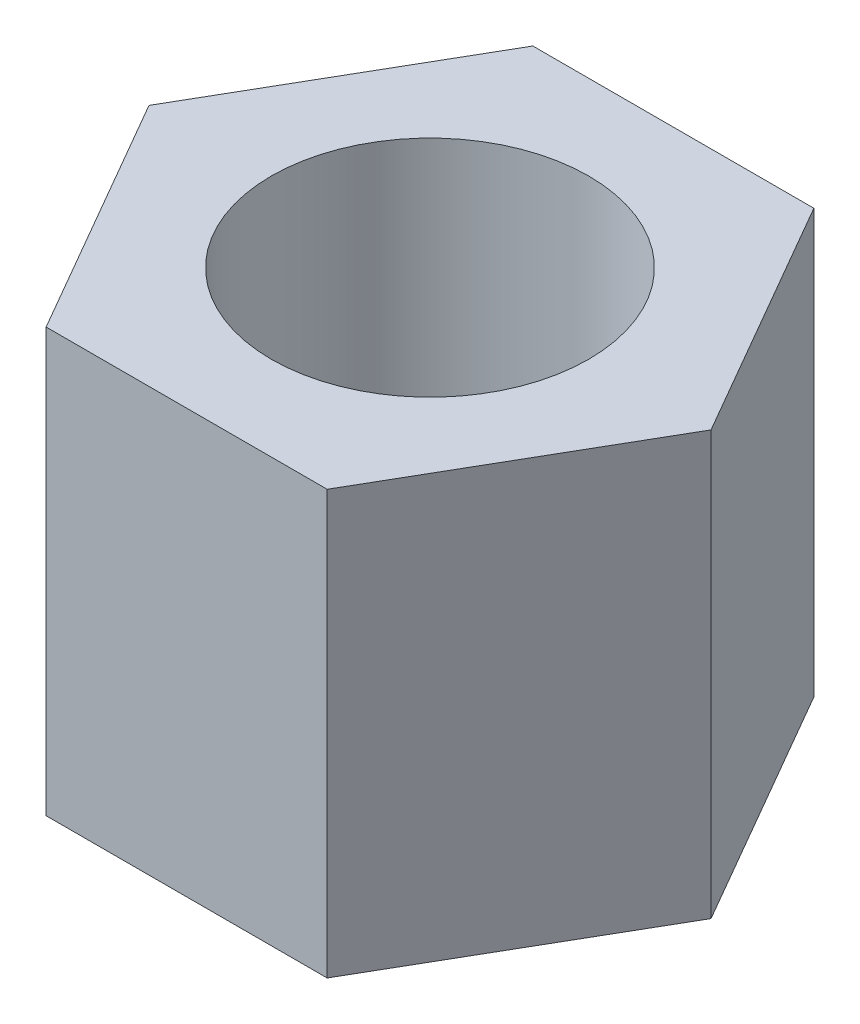
from build123d import *

# Parameters (mm, degrees)
EXTRUDE_1_DEPTH     = 4
SKETCH_4_R          = 1.5
CUT_EXTRUDE_1_DEPTH = 4


with BuildPart() as part:
    # 草图1 → 凸台-拉伸1 (new body)
    with BuildSketch(Plane(origin=(0, 0, 0), x_dir=(1, 0, 0), z_dir=(0, 1, 0))):
        Polygon((-1.327905619, 2.3), (-2.655811238, 0), (-1.327905619, -2.3), (1.327905619, -2.3), (2.655811238, 0), (1.327905619, 2.3), align=None)
    extrude(amount=EXTRUDE_1_DEPTH)

    # 草图4 → 切除-拉伸1 (cut)
    with BuildSketch(Plane.XZ):
        with Locations(Location((0, 0, 0), (0, 0, 270))):
            Circle(SKETCH_4_R)
    extrude(amount=-CUT_EXTRUDE_1_DEPTH, mode=Mode.SUBTRACT)


solid = part.part
